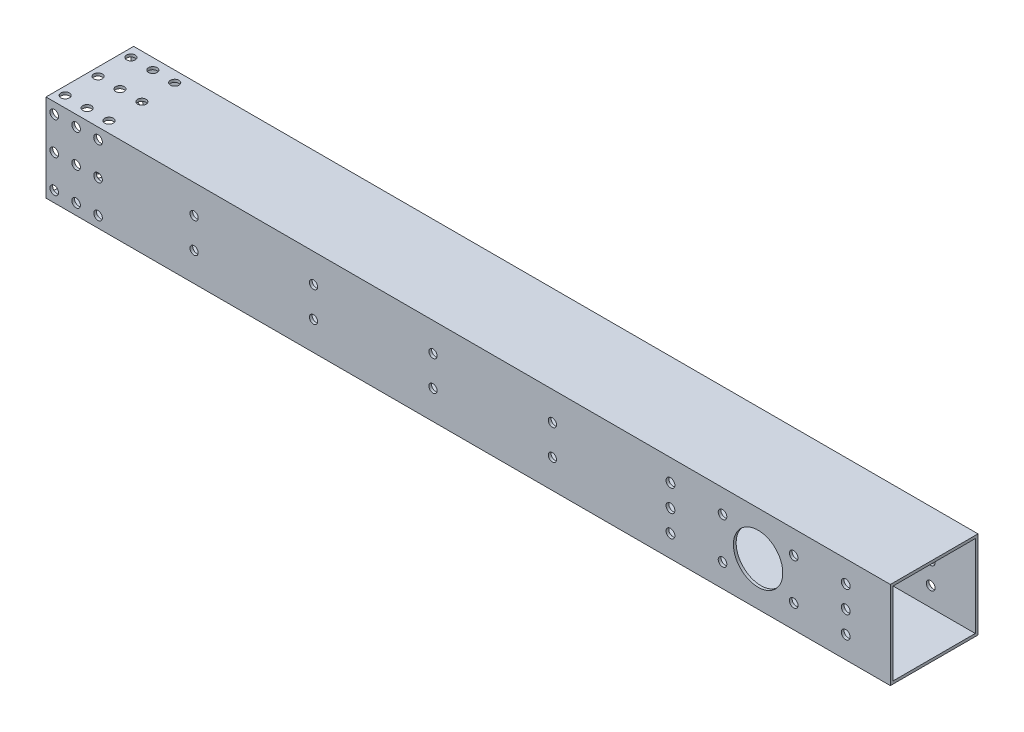
from build123d import *

# Parameters (mm, degrees)
CROQUIS5_W              = 660.4
CROQUIS5_H              = 25.4
SALIENTE_EXTRUIR1_DEPTH = 25.4
CROQUIS6_W              = 50.8
CROQUIS6_H              = 133.35
SALIENTE_EXTRUIR2_DEPTH = 25.4
VACIADO1_T              = -3.175
VACIADO2_T              = -3.175
CROQUIS7_R              = 2.4892
CORTAR_EXTRUIR1_DEPTH   = 402.404309499
CROQUIS9_W              = 489.4072
CROQUIS9_H              = 50.8
SALIENTE_EXTRUIR3_DEPTH = 25.4
VACIADO3_T              = -1.5875
CROQUIS10_R             = 2.4892
CROQUIS10_R_2           = 14.3129
CORTAR_EXTRUIR2_DEPTH   = 25.4
CROQUIS11_R             = 2.5527
CORTAR_EXTRUIR3_DEPTH   = 463.075777967
CROQUIS49_R             = 2.4892
CORTAR_EXTRUIR19_DEPTH  = 463.075777967
MATRIZC1_COUNT          = 2
MATRIZC1_ANGLE          = 90
CROQUIS50_R             = 2.38125
CORTAR_EXTRUIR20_DEPTH  = 463.075777967


with BuildPart() as part:
    # Croquis5 → Saliente-Extruir1 (new body)
    with BuildSketch(Plane.XY):
        with Locations((0, 80.772)):
            Rectangle(CROQUIS5_W, CROQUIS5_H)
    extrude(amount=-SALIENTE_EXTRUIR1_DEPTH)

    # Vaciado2
    vaciado2_openings = [part.faces().sort_by_distance(p)[0] for p in [
        (330.2, 80.772, -12.7),
        (-330.2, 80.772, -12.7),
    ]]
    offset(amount=VACIADO2_T, openings=vaciado2_openings, kind=Kind.INTERSECTION)


with BuildPart() as body_2:
    # Croquis6 → Saliente-Extruir2 (new body)
    with BuildSketch(Plane.XY):
        with Locations((0, 160.147)):
            Rectangle(CROQUIS6_W, CROQUIS6_H)
    extrude(amount=-SALIENTE_EXTRUIR2_DEPTH)

    # Vaciado1
    vaciado1_openings = [body_2.faces().sort_by_distance(p)[0] for p in [
        (0, 226.822, -12.7),
        (0, 93.472, -12.7),
    ]]
    offset(amount=VACIADO1_T, openings=vaciado1_openings, kind=Kind.INTERSECTION)

    # Croquis7 → Cortar-Extruir1 (cut, through all)
    with BuildSketch(Plane.XY):
        with Locations((0, 199.8345)):
            Circle(CROQUIS7_R)
        with Locations((0, 152.2095)):
            Circle(CROQUIS7_R)
        with BuildLine():
            Line((-11.1506, 158.5214), (11.1506, 158.5214))
            ThreePointArc((11.1506, 158.5214), (15.640728061, 160.381271939), (17.5006, 164.8714))
            Line((17.5006, 164.8714), (17.5006, 187.1726))
            ThreePointArc((17.5006, 187.1726), (15.640728061, 191.662728061), (11.1506, 193.5226))
            Line((11.1506, 193.5226), (-11.1506, 193.5226))
            ThreePointArc((-11.1506, 193.5226), (-15.640728061, 191.662728061), (-17.5006, 187.1726))
            Line((-17.5006, 187.1726), (-17.5006, 164.8714))
            ThreePointArc((-17.5006, 164.8714), (-15.640728061, 160.381271939), (-11.1506, 158.5214))
        make_face()
    extrude(amount=-CORTAR_EXTRUIR1_DEPTH, mode=Mode.SUBTRACT)


with BuildPart() as body_3:
    # Croquis9 → Saliente-Extruir3 (new, symmetric)
    with BuildSketch(Plane(origin=(0, 0, -85.440650048), x_dir=(-1, 0, 0), z_dir=(0, 0, -1))):
        with Locations((168.0464, 176.022)):
            Rectangle(CROQUIS9_W, CROQUIS9_H)
    extrude(amount=SALIENTE_EXTRUIR3_DEPTH, both=True)

    # Vaciado3
    vaciado3_openings = [body_3.faces().sort_by_distance(p)[0] for p in [
        (-412.75, 176.022, -85.440650048),
        (76.6572, 176.022, -85.440650048),
    ]]
    offset(amount=VACIADO3_T, openings=vaciado3_openings, kind=Kind.INTERSECTION)

    # Croquis10 → Cortar-Extruir2 (cut, symmetric)
    with BuildSketch(Plane.XY.offset(-85.440650048)):
        with Locations(Location((-20.622229928, 187.92825, 0), (0, 0, 180))):
            Circle(CROQUIS10_R)
        with Locations(Location((-20.622229928, 164.11575, 0), (0, 0, 180))):
            Circle(CROQUIS10_R)
        with Locations((20.622229928, 164.11575)):
            Circle(CROQUIS10_R)
        with Locations(Location((20.622229928, 187.92825, 0), (0, 0, 180))):
            Circle(CROQUIS10_R)
        with Locations(Location((0, 176.022, 0), (0, 0, 180))):
            Circle(CROQUIS10_R_2)
    extrude(amount=CORTAR_EXTRUIR2_DEPTH, both=True, mode=Mode.SUBTRACT)

    # Croquis11 → Cortar-Extruir3 (cut, through all)
    with BuildSketch(Plane.XY.offset(-60.040650048)):
        with Locations((-50.8, 188.722)):
            Circle(CROQUIS11_R)
        with Locations((-50.8, 176.022)):
            Circle(CROQUIS11_R)
        with Locations((-50.8, 163.322)):
            Circle(CROQUIS11_R)
        with Locations((50.8, 163.322)):
            Circle(CROQUIS11_R)
        with Locations((50.8, 176.022)):
            Circle(CROQUIS11_R)
        with Locations((50.8, 188.722)):
            Circle(CROQUIS11_R)
    extrude(amount=-CORTAR_EXTRUIR3_DEPTH, mode=Mode.SUBTRACT)

    # Croquis49 → Cortar-Extruir19 (cut, through all)
    with BuildSketch(Plane(origin=(0, 0, -110.840650048), x_dir=(-1, 0, 0), z_dir=(0, 0, -1))):
        with Locations((407.9875, 195.072)):
            Circle(CROQUIS49_R)
        with Locations((407.9875, 176.022)):
            Circle(CROQUIS49_R)
        with Locations((407.9875, 156.972)):
            Circle(CROQUIS49_R)
        with Locations((395.2875, 195.072)):
            Circle(CROQUIS49_R)
        with Locations((395.2875, 176.022)):
            Circle(CROQUIS49_R)
        with Locations((395.2875, 156.972)):
            Circle(CROQUIS49_R)
        with Locations((382.5875, 195.072)):
            Circle(CROQUIS49_R)
        with Locations((382.5875, 176.022)):
            Circle(CROQUIS49_R)
        with Locations((382.5875, 156.972)):
            Circle(CROQUIS49_R)
    cortar_extruir19 = extrude(amount=-CORTAR_EXTRUIR19_DEPTH, mode=Mode.SUBTRACT)

    # MatrizC1: Cortar-Extruir19 ×2 about axis
    matrizc1_axis = Axis((101.12756, 176.022, -85.440650048), (-1, 0, 0))
    for i in range(1, MATRIZC1_COUNT):
        add(cortar_extruir19.rotate(matrizc1_axis, i * MATRIZC1_ANGLE / (MATRIZC1_COUNT - 1)), mode=Mode.SUBTRACT)

    # Croquis50 → Cortar-Extruir20 (cut, through all)
    with BuildSketch(Plane(origin=(0, 0, -110.840650048), x_dir=(-1, 0, 0), z_dir=(0, 0, -1))):
        with Locations((326.91705, 167.29075)):
            Circle(CROQUIS50_R)
        with Locations((326.91705, 184.75325)):
            Circle(CROQUIS50_R)
        with Locations((257.68935, 167.29075)):
            Circle(CROQUIS50_R)
        with Locations((257.68935, 184.75325)):
            Circle(CROQUIS50_R)
        with Locations((188.46165, 167.29075)):
            Circle(CROQUIS50_R)
        with Locations((188.46165, 184.75325)):
            Circle(CROQUIS50_R)
        with Locations((119.23395, 167.29075)):
            Circle(CROQUIS50_R)
        with Locations((119.23395, 184.75325)):
            Circle(CROQUIS50_R)
    extrude(amount=-CORTAR_EXTRUIR20_DEPTH, mode=Mode.SUBTRACT)


solid = body_3.part
